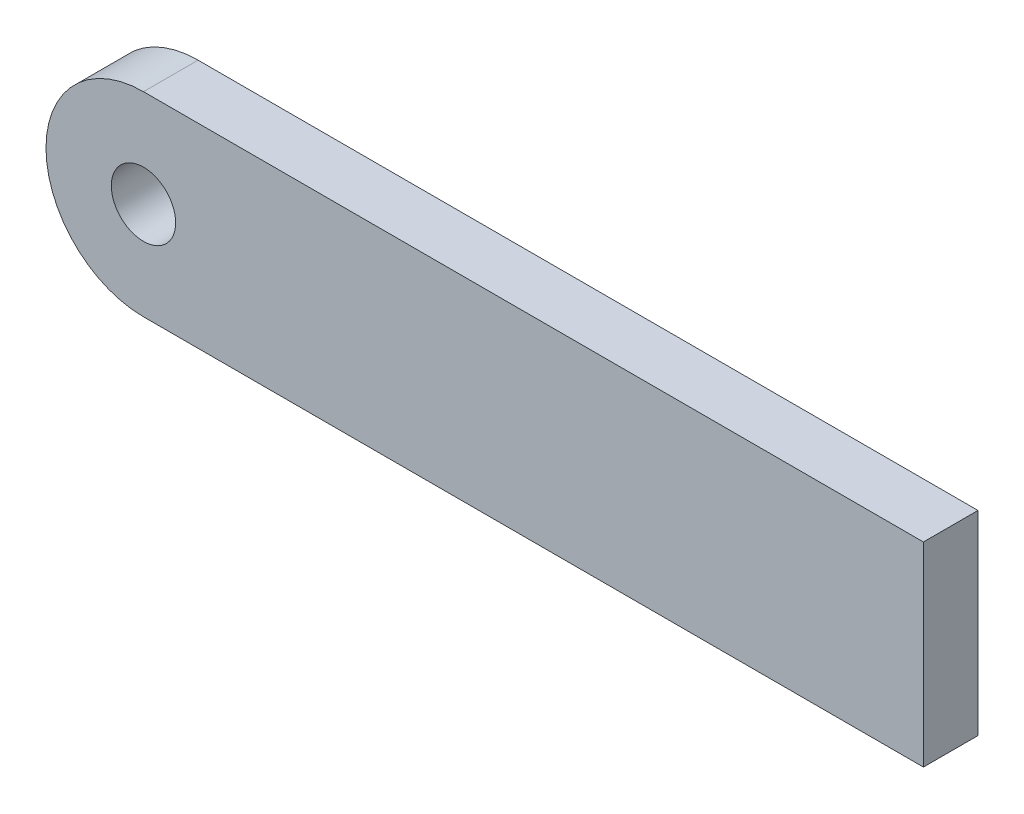
from build123d import *

# Parameters (mm, degrees)
ESQUISSE1_R        = 1.65
BOSS_EXTRU_1_DEPTH = 1.4


with BuildPart() as part:
    # Esquisse1 → Boss.-Extru.1 (new, symmetric)
    with BuildSketch(Plane.XY):
        with BuildLine():
            Line((0, -5), (40, -5))
            Line((40, -5), (40, 5))
            Line((40, 5), (0, 5))
            ThreePointArc((0, 5), (-5, 0), (0, -5))
        make_face()
        Circle(ESQUISSE1_R, mode=Mode.SUBTRACT)
    extrude(amount=BOSS_EXTRU_1_DEPTH, both=True)


solid = part.part
